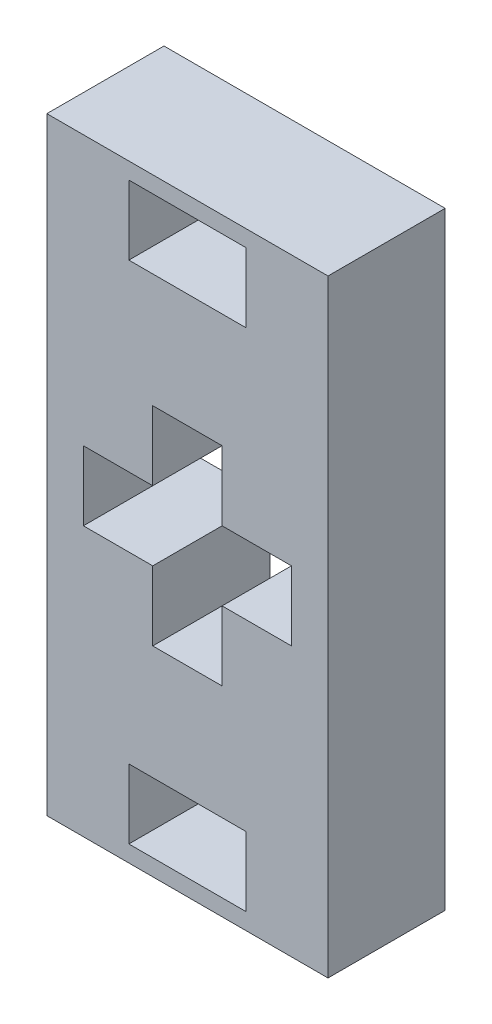
from build123d import *

# Parameters (mm, degrees)
SKETCH1_W           = 7.62
SKETCH1_H           = 16.47698
BOSS_EXTRUDE1_DEPTH = 3.175
SKETCH2_W           = 3.175
SKETCH2_H           = 1.8796
CUT_EXTRUDE1_DEPTH  = 3.175


with BuildPart() as part:
    # Sketch1 → Boss-Extrude1 (new body)
    with BuildSketch(Plane.XY):
        with Locations((3.81, 8.23849)):
            Rectangle(SKETCH1_W, SKETCH1_H)
    extrude(amount=BOSS_EXTRUDE1_DEPTH)

    # Sketch2 → Cut-Extrude1 (cut)
    with BuildSketch(Plane.XY.offset(3.175)):
        Polygon((2.8702, 11.05789), (4.7498, 11.05789), (4.7498, 9.17829), (6.6294, 9.17829), (6.6294, 7.29869), (4.7498, 7.29869), (4.7498, 5.41909), (2.8702, 5.41909), (2.8702, 7.29869), (0.9906, 7.29869), (0.9906, 9.17829), (2.8702, 9.17829), align=None)
        with Locations((3.81, 15.090268823)):
            Rectangle(SKETCH2_W, SKETCH2_H)
        with Locations((3.81, 1.386968823)):
            Rectangle(SKETCH2_W, SKETCH2_H)
    extrude(amount=-CUT_EXTRUDE1_DEPTH, mode=Mode.SUBTRACT)


solid = part.part
